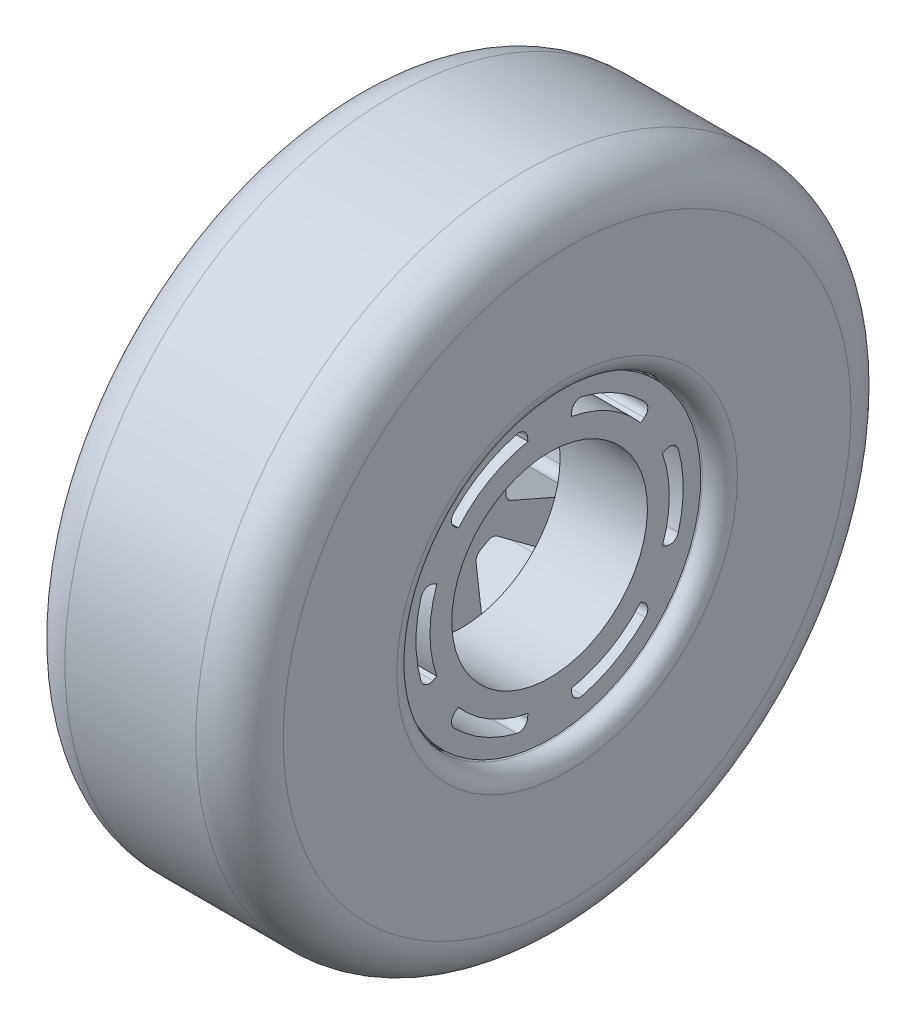
from build123d import *

# Parameters (mm, degrees)
CUT_EXTRUDE1_DEPTH  = 58.805709125
SKETCH5_R           = 11.2
CUT_EXTRUDE2_DEPTH  = 10
FILLET1_R           = 1
FILLET2_R           = 1
SKETCH6_R           = 13.7
SKETCH6_R_2         = 11.2
BOSS_EXTRUDE3_DEPTH = 10


with BuildPart() as part:
    # Sketch2 → Revolve2 (revolve)
    with BuildSketch(Plane.XY, mode=Mode.PRIVATE) as revolve2_sk:
        with BuildLine():
            Line((7.5, -37.5), (-7.5, -37.5))
            ThreePointArc((-7.5, -37.5), (-11.035533906, -36.035533906), (-12.5, -32.5))
            Line((-12.5, -32.5), (-12.5, -19.5))
            ThreePointArc((-12.5, -19.5), (-11.914213562, -18.085786438), (-10.5, -17.5))
            Line((-10.5, -17.5), (-9, -17.5))
            Line((-9, -17.5), (-5, -21.5))
            Line((-5, -21.5), (5, -21.5))
            Line((5, -21.5), (9, -17.5))
            Line((9, -17.5), (10.5, -17.5))
            ThreePointArc((10.5, -17.5), (11.914213562, -18.085786438), (12.5, -19.5))
            Line((12.5, -19.5), (12.5, -32.5))
            ThreePointArc((12.5, -32.5), (11.035533906, -36.035533906), (7.5, -37.5))
        make_face()
    revolve(revolve2_sk.sketch.rotate(Axis((0, 0, 0), (-1, 0, 0)), 270), axis=Axis((0, 0, 0), (-1, 0, 0)))


with BuildPart() as body_2:
    # Sketch3 → Revolve3 (revolve)
    with BuildSketch(Plane.XY, mode=Mode.PRIVATE) as revolve3_sk:
        Polygon((10.5, 0), (-10.5, 0), (-10.5, -17.3), (-8.917157288, -17.3), (-4.917157288, -21.3), (4.917157288, -21.3), (8.917157288, -17.3), (10.5, -17.3), align=None)
    revolve(revolve3_sk.sketch.rotate(Axis((10.5, 0, 0), (-1, 0, 0)), 180), axis=Axis((10.5, 0, 0), (-1, 0, 0)))

    # Sketch4 → Cut-Extrude1 (cut, through all)
    with BuildSketch(Plane.ZY.offset(10.5)):
        with BuildLine():
            Line((-1.5, 4.769696007), (-2.656817118, 15.067558621))
            ThreePointArc((-2.656817118, 15.067558621), (-7.65, 13.250188678), (-11.72047998, 9.834650428))
            Line((-11.72047998, 9.834650428), (-3.38067791, 3.683886109))
            ThreePointArc((-3.38067791, 3.683886109), (-2.5, 4.330127019), (-1.5, 4.769696007))
        make_face()
        with BuildLine():
            ThreePointArc((11.72047998, 9.834650428), (7.65, 13.250188678), (2.656817118, 15.067558621))
            Line((2.656817118, 15.067558621), (1.5, 4.769696007))
            ThreePointArc((1.5, 4.769696007), (2.5, 4.330127019), (3.38067791, 3.683886109))
            Line((3.38067791, 3.683886109), (11.72047998, 9.834650428))
        make_face()
        with BuildLine():
            ThreePointArc((15.3, 0), (15.067558621, 2.656817118), (14.377297098, 5.232908193))
            Line((14.377297098, 5.232908193), (4.88067791, 1.085809898))
            ThreePointArc((4.88067791, 1.085809898), (4.970079957, 0.546173254), (5, 0))
            ThreePointArc((5, 0), (4.970079957, -0.546173254), (4.88067791, -1.085809898))
            Line((4.88067791, -1.085809898), (14.377297098, -5.232908193))
            ThreePointArc((14.377297098, -5.232908193), (15.067558621, -2.656817118), (15.3, 0))
        make_face()
        with BuildLine():
            ThreePointArc((2.656817118, -15.067558621), (7.65, -13.250188678), (11.72047998, -9.834650428))
            Line((11.72047998, -9.834650428), (3.38067791, -3.683886109))
            ThreePointArc((3.38067791, -3.683886109), (2.5, -4.330127019), (1.5, -4.769696007))
            Line((1.5, -4.769696007), (2.656817118, -15.067558621))
        make_face()
        with BuildLine():
            Line((-3.38067791, -3.683886109), (-11.72047998, -9.834650428))
            ThreePointArc((-11.72047998, -9.834650428), (-7.65, -13.250188678), (-2.656817118, -15.067558621))
            Line((-2.656817118, -15.067558621), (-1.5, -4.769696007))
            ThreePointArc((-1.5, -4.769696007), (-2.5, -4.330127019), (-3.38067791, -3.683886109))
        make_face()
        with BuildLine():
            Line((-4.88067791, 1.085809898), (-14.377297098, 5.232908193))
            ThreePointArc((-14.377297098, 5.232908193), (-15.3, 0), (-14.377297098, -5.232908193))
            Line((-14.377297098, -5.232908193), (-4.88067791, -1.085809898))
            ThreePointArc((-4.88067791, -1.085809898), (-5, 0), (-4.88067791, 1.085809898))
        make_face()
    extrude(amount=-CUT_EXTRUDE1_DEPTH, mode=Mode.SUBTRACT)

    # Sketch5 → Cut-Extrude2 (cut)
    with BuildSketch(Plane(origin=(10.5, 0, 0), x_dir=(0, 0, -1), z_dir=(1, 0, 0))):
        Circle(SKETCH5_R)
    extrude(amount=-CUT_EXTRUDE2_DEPTH, mode=Mode.SUBTRACT)

    # Fillet1
    fillet1_edges = [body_2.edges().sort_by_distance(p)[0] for p in [
        (-5, -3.683886109, -3.38067791),
        (-5, -4.769696007, -1.5),
        (-5, -4.769696007, 1.5),
        (-5, -3.683886109, 3.38067791),
        (-5, 3.683886109, 3.38067791),
        (-5, 4.769696007, 1.5),
        (-5, -1.085809898, 4.88067791),
        (-5, 1.085809898, 4.88067791),
        (-5, 1.085809898, -4.88067791),
        (-5, -1.085809898, -4.88067791),
        (-5, 4.769696007, -1.5),
        (-5, 3.683886109, -3.38067791),
        (0, -15.067558621, -2.656817118),
        (0, -9.834650428, -11.72047998),
        (0, -9.834650428, 11.72047998),
        (0, -15.067558621, 2.656817118),
        (0, 15.067558621, 2.656817118),
        (0, 9.834650428, 11.72047998),
        (0, 5.232908193, 14.377297098),
        (0, -5.232908193, 14.377297098),
        (0, -5.232908193, -14.377297098),
        (0, 5.232908193, -14.377297098),
        (0, 9.834650428, -11.72047998),
        (0, 15.067558621, -2.656817118),
    ]]
    fillet(fillet1_edges, radius=FILLET1_R)

    # Fillet2
    fillet2_edges = [body_2.edges().sort_by_distance(p)[0] for p in [
        (-10.5, 3.091218526, -9.472949591),
        (-10.5, 0, -5),
        (-10.5, -3.091218526, -9.472949591),
        (-10.5, 4.330127019, -2.5),
        (-10.5, 6.658205731, -7.413548567),
        (-10.5, 9.749424257, -2.059401023),
        (-10.5, 4.330127019, 2.5),
        (-10.5, 9.749424257, 2.059401023),
        (-10.5, 6.658205731, 7.413548567),
        (-10.5, 0, 5),
        (-10.5, 3.091218526, 9.472949591),
        (-10.5, -3.091218526, 9.472949591),
        (-10.5, -4.330127019, 2.5),
        (-10.5, -6.658205731, 7.413548567),
        (-10.5, -9.749424257, 2.059401023),
        (-10.5, -4.330127019, -2.5),
        (-10.5, -9.749424257, -2.059401023),
        (-10.5, -6.658205731, -7.413548567),
        (-10.5, 0, -15.3),
        (-10.5, -13.250188678, -7.65),
        (-10.5, -13.250188678, 7.65),
        (-10.5, 0, 15.3),
        (-10.5, 13.250188678, 7.65),
        (-10.5, 13.250188678, -7.65),
        (-10.5, 0.989229967, -5.123389157),
        (-10.5, -0.989229967, -5.123389157),
        (-10.5, 3.94237018, -3.41839286),
        (-10.5, 4.931600147, -1.704996297),
        (-10.5, 4.931600147, 1.704996297),
        (-10.5, 3.94237018, 3.41839286),
        (-10.5, 0.989229967, 5.123389157),
        (-10.5, -0.989229967, 5.123389157),
        (-10.5, -3.94237018, 3.41839286),
        (-10.5, -4.931600147, 1.704996297),
        (-10.5, -4.931600147, -1.704996297),
        (-10.5, -3.94237018, -3.41839286),
        (-10.5, -4.778140696, -14.193203965),
        (-10.5, 4.778140696, -14.193203965),
        (-10.5, -9.902604846, -11.234593208),
        (-10.5, -14.680745543, -2.958610756),
        (-10.5, -14.680745543, 2.958610756),
        (-10.5, -9.902604846, 11.234593208),
        (-10.5, -4.778140696, 14.193203965),
        (-10.5, 4.778140696, 14.193203965),
        (-10.5, 9.902604846, 11.234593208),
        (-10.5, 14.680745543, 2.958610756),
        (-10.5, 14.680745543, -2.958610756),
        (-10.5, 9.902604846, -11.234593208),
    ]]
    fillet(fillet2_edges, radius=FILLET2_R)

    # Sketch6 → Boss-Extrude3 (add)
    with BuildSketch(Plane(origin=(0.5, 0, 0), x_dir=(0, 0, -1), z_dir=(1, 0, 0))):
        Circle(SKETCH6_R)
        with Locations(Location((0, 0, 0), (0, 0, 90))):
            Circle(SKETCH6_R_2, mode=Mode.SUBTRACT)
    extrude(amount=BOSS_EXTRUDE3_DEPTH)


solid = Compound([part.part, body_2.part])
